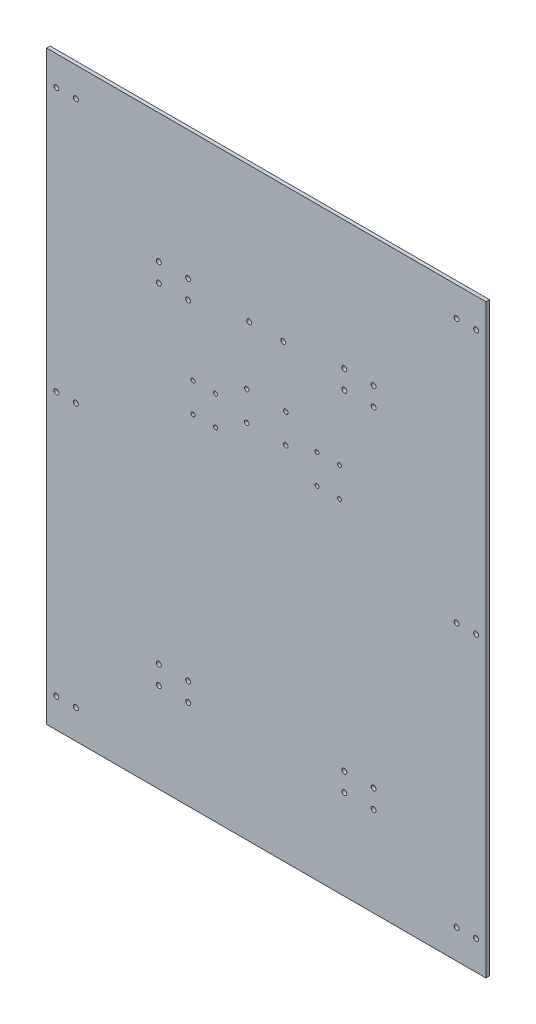
from build123d import *

# Parameters (mm, degrees)
SKETCH_1_W          = 450
SKETCH_1_H          = 600
EXTRUDE_1_DEPTH     = 3.6
SKETCH_4_R          = 2.5
CUT_EXTRUDE_3_DEPTH = 3.6
SKETCH_5_R          = 2
CUT_EXTRUDE_4_DEPTH = 10
SKETCH_6_R          = 2
CUT_EXTRUDE_5_DEPTH = 10
SKETCH_7_R          = 2.5
CUT_EXTRUDE_6_DEPTH = 10
SKETCH_8_R          = 2.25
CUT_EXTRUDE_7_DEPTH = 376.017279602
SKETCH_9_R          = 2.5
CUT_EXTRUDE_8_DEPTH = 376.017279602


with BuildPart() as part:
    # 草图1 → 凸台-拉伸1 (new body)
    with BuildSketch(Plane.XY):
        Rectangle(SKETCH_1_W, SKETCH_1_H)
    extrude(amount=EXTRUDE_1_DEPTH)

    # 草图4 → 切除-拉伸3 (cut)
    with BuildSketch(Plane.XY.offset(3.6)):
        with Locations((-195, 270)):
            Circle(SKETCH_4_R)
        with Locations((-195, -270)):
            Circle(SKETCH_4_R)
        with Locations((195, -270)):
            Circle(SKETCH_4_R)
        with Locations((195, 270)):
            Circle(SKETCH_4_R)
        with Locations((-195, 0)):
            Circle(SKETCH_4_R)
        with Locations((195, 0)):
            Circle(SKETCH_4_R)
        with Locations(Location((-215, -270, 0), (0, 0, 180))):
            Circle(SKETCH_4_R)
        with Locations(Location((-215, 0, 0), (0, 0, 180))):
            Circle(SKETCH_4_R)
        with Locations(Location((-215, 270, 0), (0, 0, 180))):
            Circle(SKETCH_4_R)
        with Locations((215, 270)):
            Circle(SKETCH_4_R)
        with Locations((215, 0)):
            Circle(SKETCH_4_R)
        with Locations((215, -270)):
            Circle(SKETCH_4_R)
    extrude(amount=-CUT_EXTRUDE_3_DEPTH, mode=Mode.SUBTRACT)

    # 草图5 → 切除-拉伸4 (cut)
    with BuildSketch(Plane.XY.offset(3.6)):
        with Locations((-75, 50)):
            Circle(SKETCH_5_R)
        with Locations((-75, 80)):
            Circle(SKETCH_5_R)
        with Locations((-52, 50)):
            Circle(SKETCH_5_R)
        with Locations((-52, 80)):
            Circle(SKETCH_5_R)
    extrude(amount=-CUT_EXTRUDE_4_DEPTH, mode=Mode.SUBTRACT)

    # 草图6 → 切除-拉伸5 (cut)
    with BuildSketch(Plane.XY.offset(3.6)):
        with Locations((52, 50)):
            Circle(SKETCH_6_R)
        with Locations((52, 80)):
            Circle(SKETCH_6_R)
        with Locations((75, 50)):
            Circle(SKETCH_6_R)
        with Locations((75, 80)):
            Circle(SKETCH_6_R)
    extrude(amount=-CUT_EXTRUDE_5_DEPTH, mode=Mode.SUBTRACT)

    # 草图7 → 切除-拉伸6 (cut)
    with BuildSketch(Plane.XY.offset(3.6)):
        with Locations((-17.5, 161)):
            Circle(SKETCH_7_R)
        with Locations((17.5, 161)):
            Circle(SKETCH_7_R)
    extrude(amount=-CUT_EXTRUDE_6_DEPTH, mode=Mode.SUBTRACT)

    # 草图8 → 切除-拉伸7 (cut, through all)
    with BuildSketch(Plane.XY.offset(3.6)):
        with Locations((-20, 70)):
            Circle(SKETCH_8_R)
        with Locations((-20, 100)):
            Circle(SKETCH_8_R)
        with Locations((20, 70)):
            Circle(SKETCH_8_R)
        with Locations((20, 100)):
            Circle(SKETCH_8_R)
    extrude(amount=-CUT_EXTRUDE_7_DEPTH, mode=Mode.SUBTRACT)

    # 草图9 → 切除-拉伸8 (cut, through all)
    with BuildSketch(Plane.XY.offset(3.6)):
        with Locations((-110, -208)):
            Circle(SKETCH_9_R)
        with Locations((-110, -189)):
            Circle(SKETCH_9_R)
        with Locations((-80, -208)):
            Circle(SKETCH_9_R)
        with Locations((-80, -189)):
            Circle(SKETCH_9_R)
        with Locations((80, -208)):
            Circle(SKETCH_9_R)
        with Locations((80, -189)):
            Circle(SKETCH_9_R)
        with Locations((110, -189)):
            Circle(SKETCH_9_R)
        with Locations((110, -208)):
            Circle(SKETCH_9_R)
        with Locations((110, 149)):
            Circle(SKETCH_9_R)
        with Locations((110, 168)):
            Circle(SKETCH_9_R)
        with Locations((80, 149)):
            Circle(SKETCH_9_R)
        with Locations((80, 168)):
            Circle(SKETCH_9_R)
        with Locations((-80, 149)):
            Circle(SKETCH_9_R)
        with Locations((-80, 168)):
            Circle(SKETCH_9_R)
        with Locations((-110, 149)):
            Circle(SKETCH_9_R)
        with Locations((-110, 168)):
            Circle(SKETCH_9_R)
    extrude(amount=-CUT_EXTRUDE_8_DEPTH, mode=Mode.SUBTRACT)


solid = part.part
